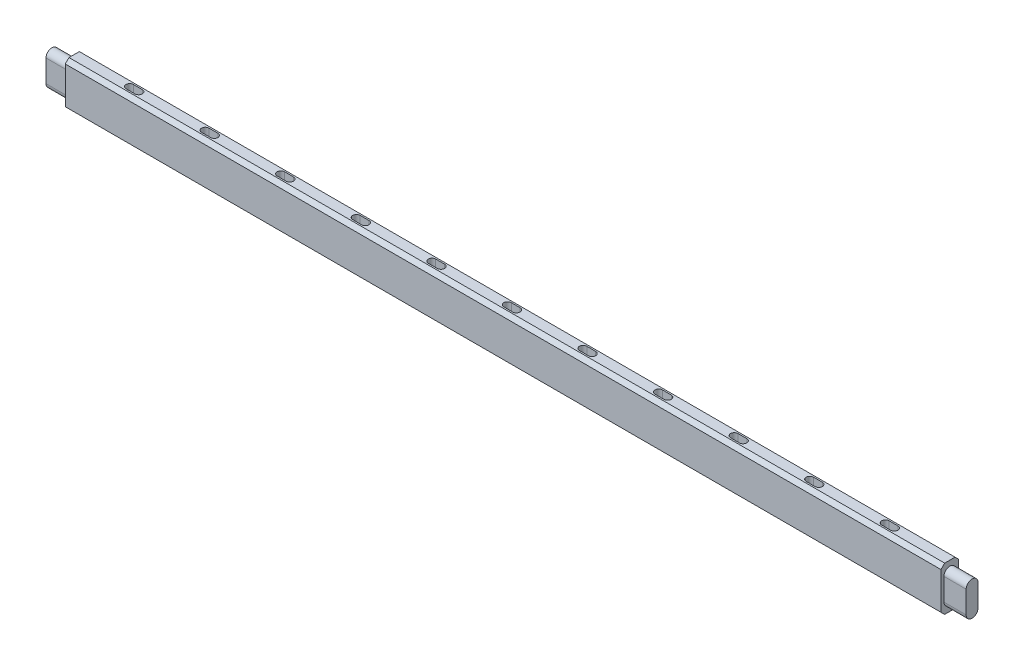
from build123d import *

# Parameters (mm, degrees)
ESQUISSE1_W             = 1182
ESQUISSE1_H             = 60
BOSS_EXTRU_1_DEPTH      = 24
BOSS_EXTRU_2_DEPTH      = 30
BOSS_EXTRU_3_START      = -1212
BOSS_EXTRU_3_DEPTH      = 30
CHANFREIN1_SIZE         = 5
ENL_V_MAT_EXTRU_1_DEPTH = 15


with BuildPart() as part:
    # Esquisse1 → Boss.-Extru.1 (new body)
    with BuildSketch(Plane.XY):
        with Locations((591, 30)):
            Rectangle(ESQUISSE1_W, ESQUISSE1_H)
    extrude(amount=BOSS_EXTRU_1_DEPTH)

    # Esquisse2 → Boss.-Extru.2 (add)
    with BuildSketch(Plane.ZY):
        with BuildLine():
            Line((4, 15), (4, 45))
            ThreePointArc((4, 45), (12, 53), (20, 45))
            Line((20, 45), (20, 15))
            ThreePointArc((20, 15), (12, 7), (4, 15))
        make_face()
    extrude(amount=BOSS_EXTRU_2_DEPTH)

    # Esquisse2<2> → Boss.-Extru.3 (add)
    with BuildSketch(Plane.ZY.offset(BOSS_EXTRU_3_START)):
        with BuildLine():
            Line((4, 15), (4, 45))
            ThreePointArc((4, 45), (12, 53), (20, 45))
            Line((20, 45), (20, 15))
            ThreePointArc((20, 15), (12, 7), (4, 15))
        make_face()
    extrude(amount=BOSS_EXTRU_3_DEPTH)

    # Chanfrein1
    chanfrein1_edges = [part.edges().sort_by_distance(p)[0] for p in [
        (591, 60, 24),
        (591, 60, 0),
        (591, 0, 0),
        (591, 0, 24),
    ]]
    chamfer(chanfrein1_edges, length=CHANFREIN1_SIZE)

    # Esquisse3 → Enlèv. mat.-Extru.1 (cut)
    with BuildSketch(Plane(origin=(0, 60, 0), x_dir=(1, 0, 0), z_dir=(0, 1, 0))):
        with BuildLine():
            Line((483, -7), (495, -7))
            ThreePointArc((495, -7), (500, -12), (495, -17))
            Line((495, -17), (483, -17))
            ThreePointArc((483, -17), (478, -12), (483, -7))
        make_face()
        with BuildLine():
            Line((381, -7), (393, -7))
            ThreePointArc((393, -7), (398, -12), (393, -17))
            Line((393, -17), (381, -17))
            ThreePointArc((381, -17), (376, -12), (381, -7))
        make_face()
        with BuildLine():
            Line((279, -7), (291, -7))
            ThreePointArc((291, -7), (296, -12), (291, -17))
            Line((291, -17), (279, -17))
            ThreePointArc((279, -17), (274, -12), (279, -7))
        make_face()
        with BuildLine():
            Line((177, -7), (189, -7))
            ThreePointArc((189, -7), (194, -12), (189, -17))
            Line((189, -17), (177, -17))
            ThreePointArc((177, -17), (172, -12), (177, -7))
        make_face()
        with BuildLine():
            Line((75, -7), (87, -7))
            ThreePointArc((87, -7), (92, -12), (87, -17))
            Line((87, -17), (75, -17))
            ThreePointArc((75, -17), (70, -12), (75, -7))
        make_face()
        with BuildLine():
            Line((585, -7), (597, -7))
            ThreePointArc((597, -7), (602, -12), (597, -17))
            Line((597, -17), (585, -17))
            ThreePointArc((585, -17), (580, -12), (585, -7))
        make_face()
        with BuildLine():
            Line((1107, -7), (1095, -7))
            ThreePointArc((1095, -7), (1090, -12), (1095, -17))
            Line((1095, -17), (1107, -17))
            ThreePointArc((1107, -17), (1112, -12), (1107, -7))
        make_face()
        with BuildLine():
            Line((1005, -7), (993, -7))
            ThreePointArc((993, -7), (988, -12), (993, -17))
            Line((993, -17), (1005, -17))
            ThreePointArc((1005, -17), (1010, -12), (1005, -7))
        make_face()
        with BuildLine():
            Line((903, -7), (891, -7))
            ThreePointArc((891, -7), (886, -12), (891, -17))
            Line((891, -17), (903, -17))
            ThreePointArc((903, -17), (908, -12), (903, -7))
        make_face()
        with BuildLine():
            Line((801, -7), (789, -7))
            ThreePointArc((789, -7), (784, -12), (789, -17))
            Line((789, -17), (801, -17))
            ThreePointArc((801, -17), (806, -12), (801, -7))
        make_face()
        with BuildLine():
            Line((699, -7), (687, -7))
            ThreePointArc((687, -7), (682, -12), (687, -17))
            Line((687, -17), (699, -17))
            ThreePointArc((699, -17), (704, -12), (699, -7))
        make_face()
    extrude(amount=-ENL_V_MAT_EXTRU_1_DEPTH, mode=Mode.SUBTRACT)


solid = part.part
